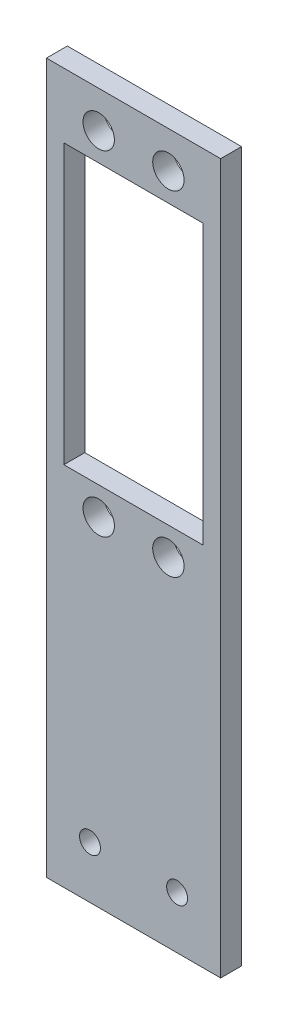
from build123d import *

# Parameters (mm, degrees)
SKETCH1_W           = 25
SKETCH1_H           = 15
SKETCH1_R           = 1.5
SKETCH1_H_2         = 86.812035999
SKETCH1_R_2         = 2.25
BOSS_EXTRUDE1_DEPTH = 3


with BuildPart() as part:
    # Sketch1 → Boss-Extrude1 (new body)
    # profile 1 of 2: a face of its own
    with BuildSketch(Plane.XY):
        with Locations((12.5, 7.5)):
            Rectangle(SKETCH1_W, SKETCH1_H)
        with Locations((6.25, 7.5)):
            Circle(SKETCH1_R, mode=Mode.SUBTRACT)
        with Locations((18.75, 7.5)):
            Circle(SKETCH1_R, mode=Mode.SUBTRACT)
    # profile 2 of 2: a face of its own
    with BuildSketch(Plane.XY):
        with Locations((12.5, 58.406018)):
            Rectangle(SKETCH1_W, SKETCH1_H_2)
        with Locations((7.5, 48.53)):
            Circle(SKETCH1_R_2, mode=Mode.SUBTRACT)
        with BuildLine():
            ThreePointArc((19.75, 48.53), (17.5, 46.28), (15.25, 48.53))
            ThreePointArc((15.25, 48.53), (17.5, 50.78), (19.75, 48.53))
        make_face(mode=Mode.SUBTRACT)
        with Locations((7.5, 96.53)):
            Circle(SKETCH1_R_2, mode=Mode.SUBTRACT)
        Polygon((2.5, 52.53), (2.5, 92.53), (12.5, 92.53), (22.5, 92.53), (22.5, 52.53), (12.5, 52.53), align=None, mode=Mode.SUBTRACT)
        with Locations((17.5, 96.53)):
            Circle(SKETCH1_R_2, mode=Mode.SUBTRACT)
    extrude(amount=BOSS_EXTRUDE1_DEPTH)


solid = part.part
